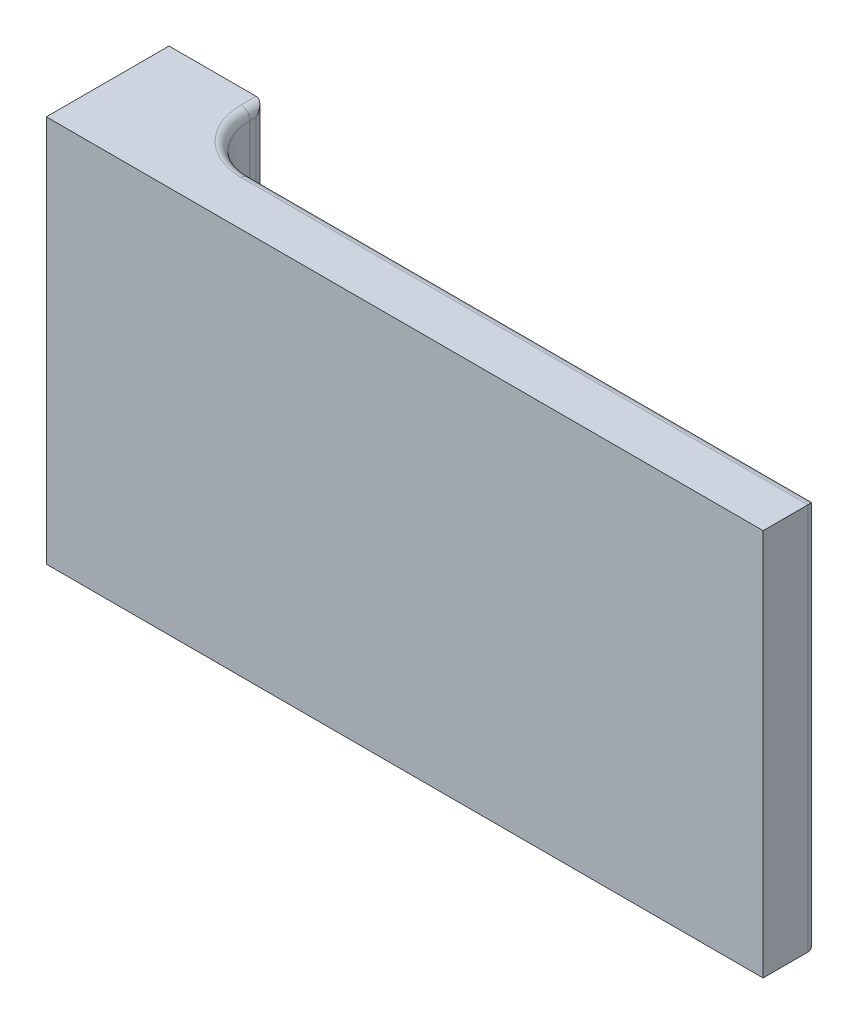
from build123d import *

# Parameters (mm, degrees)
SKETCH1_W           = 19.981739869
SKETCH1_H           = 10.800167474
BOSS_EXTRUDE1_DEPTH = 1.5
SKETCH3_W           = 2.678049678
SKETCH3_H           = 6.088868787
BOSS_EXTRUDE2_DEPTH = 1.920000865
FILLET1_R           = 1.5
FILLET2_R           = 0.25


with BuildPart() as part:
    # Sketch1 → Boss-Extrude1 (new body)
    with BuildSketch(Plane.XY):
        with Locations((-19.22144379, -14.172432084)):
            Rectangle(SKETCH1_W, SKETCH1_H)
    extrude(amount=-BOSS_EXTRUDE1_DEPTH)

    # Sketch3 → Boss-Extrude2 (add)
    with BuildSketch(Plane(origin=(0, 0, -1.5), x_dir=(-1, 0, 0), z_dir=(0, 0, -1))):
        with Locations((27.873288885, -11.816782741)):
            Rectangle(SKETCH3_W, SKETCH3_H)
    extrude(amount=BOSS_EXTRUDE2_DEPTH)

    # Fillet1
    fillet1_edges = [part.edges().sort_by_distance(p)[0] for p in [
        (-26.534264046, -11.81678274, -1.5),
    ]]
    fillet(fillet1_edges, radius=FILLET1_R)

    # Fillet2
    fillet2_edges = [part.edges().sort_by_distance(p)[0] for p in [
        (-26.534264046, -14.861217134, -3.210000433),
        (-26.534264046, -11.81678274, -3.420000865),
        (-26.534264046, -8.772348347, -3.210000433),
        (-19.221443789, -19.572515821, -1.5),
        (-26.094924218, -14.861217134, -1.939339828),
        (-26.094924218, -8.772348347, -1.939339828),
        (-9.230573855, -14.172432084, -1.5),
        (-17.13241895, -8.772348347, -1.5),
    ]]
    fillet(fillet2_edges, radius=FILLET2_R)


solid = part.part
